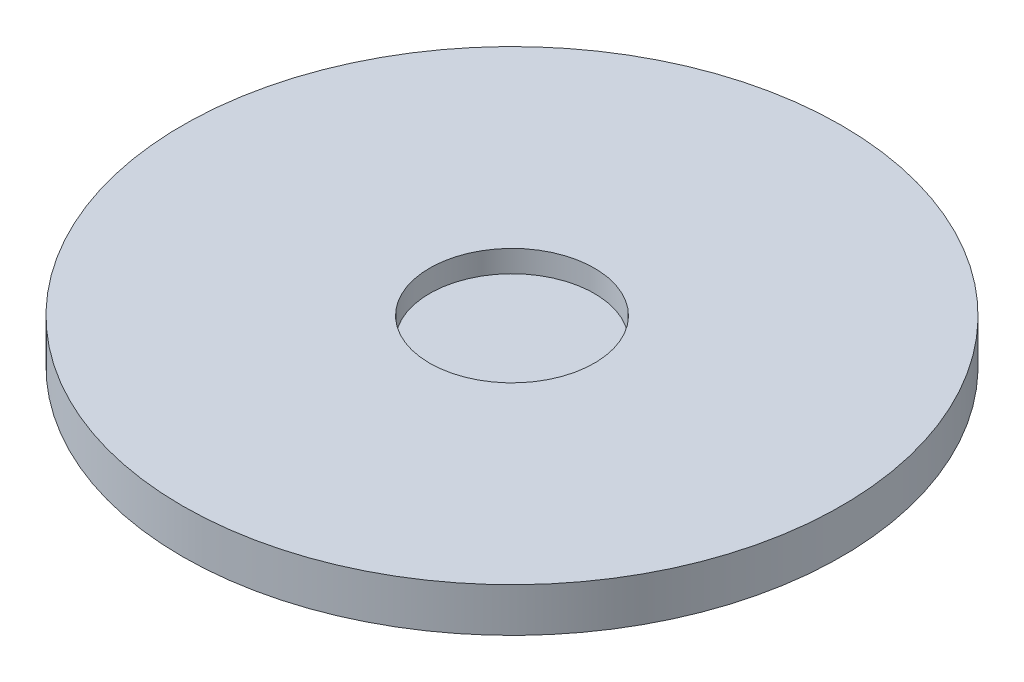
from build123d import *

# Parameters (mm, degrees)
SKETCH1_R           = 150
BOSS_EXTRUDE1_DEPTH = 20
SKETCH2_R           = 37.5
CUT_EXTRUDE1_DEPTH  = 10


with BuildPart() as part:
    # Sketch1 → Boss-Extrude1 (new body)
    with BuildSketch(Plane(origin=(0, 0, 0), x_dir=(1, 0, 0), z_dir=(0, 1, 0))):
        with Locations(Location((0, 0, 0), (0, 0, 270))):
            Circle(SKETCH1_R)
    extrude(amount=BOSS_EXTRUDE1_DEPTH)

    # Sketch2 → Cut-Extrude1 (cut)
    with BuildSketch(Plane(origin=(0, 20, 0), x_dir=(1, 0, 0), z_dir=(0, 1, 0))):
        with Locations(Location((0, 0, 0), (0, 0, 270))):
            Circle(SKETCH2_R)
    extrude(amount=-CUT_EXTRUDE1_DEPTH, mode=Mode.SUBTRACT)


solid = part.part
